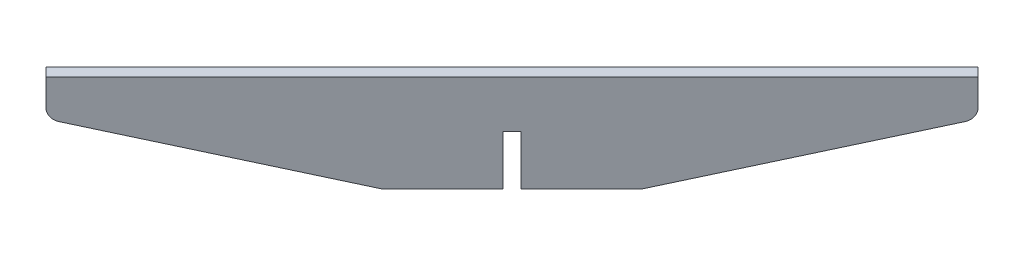
from build123d import *

# Parameters (mm, degrees)
BOSS_EXTRUDE1_DEPTH     = 15
BOSS_EXTRUDE2_DEPTH     = 5
CUT_EXTRUDE2_DEPTH      = 284.32843133
CUT_EXTRUDE2_DEPTH_BACK = 284.32843133
SKETCH4_W               = 10.2
SKETCH4_H               = 82
FILLET1_R               = 10
FILLET2_R               = 10


with BuildPart() as part:
    # Sketch1 → Boss-Extrude1 (new, symmetric)
    with BuildSketch(Plane(origin=(0, 0, 0), x_dir=(1, 0, 0), z_dir=(0, 1, 0))):
        Polygon((-195, -187.928932188), (-187.928932188, -195), (195, 187.928932188), (187.928932188, 195), align=None)
    extrude(amount=BOSS_EXTRUDE1_DEPTH, both=True)

    # Sketch3 → Boss-Extrude2 (add, symmetric)
    with BuildSketch(Plane(origin=(0, 0, 0), x_dir=(0.7071067811865476, 0, -0.7071067811865476), z_dir=(0.7071067811865476, 0, 0.7071067811865476))):
        Polygon((270.771644663, -15), (75, -65), (-75, -65), (-270.771644663, -15), align=None)
    extrude(amount=BOSS_EXTRUDE2_DEPTH, both=True)

    # Sketch4 → Cut-Extrude2 (cut, two sides: drawn at the far end of the back side and taken through both)
    with BuildSketch(Plane(origin=(0, 0, 0), x_dir=(0.7071067811865476, 0, -0.7071067811865476), z_dir=(0.7071067811865476, 0, 0.7071067811865476)).offset(-CUT_EXTRUDE2_DEPTH_BACK)):
        with Locations((0, -65)):
            Rectangle(SKETCH4_W, SKETCH4_H)
    extrude(amount=CUT_EXTRUDE2_DEPTH + CUT_EXTRUDE2_DEPTH_BACK, mode=Mode.SUBTRACT)

    # Fillet1
    fillet1_edges = [part.edges().sort_by_distance(p)[0] for p in [
        (191.464466094, -15, -191.464466094),
    ]]
    fillet(fillet1_edges, radius=FILLET1_R)

    # Fillet2
    fillet2_edges = [part.edges().sort_by_distance(p)[0] for p in [
        (-191.464466094, -15, 191.464466094),
    ]]
    fillet(fillet2_edges, radius=FILLET2_R)


solid = part.part
